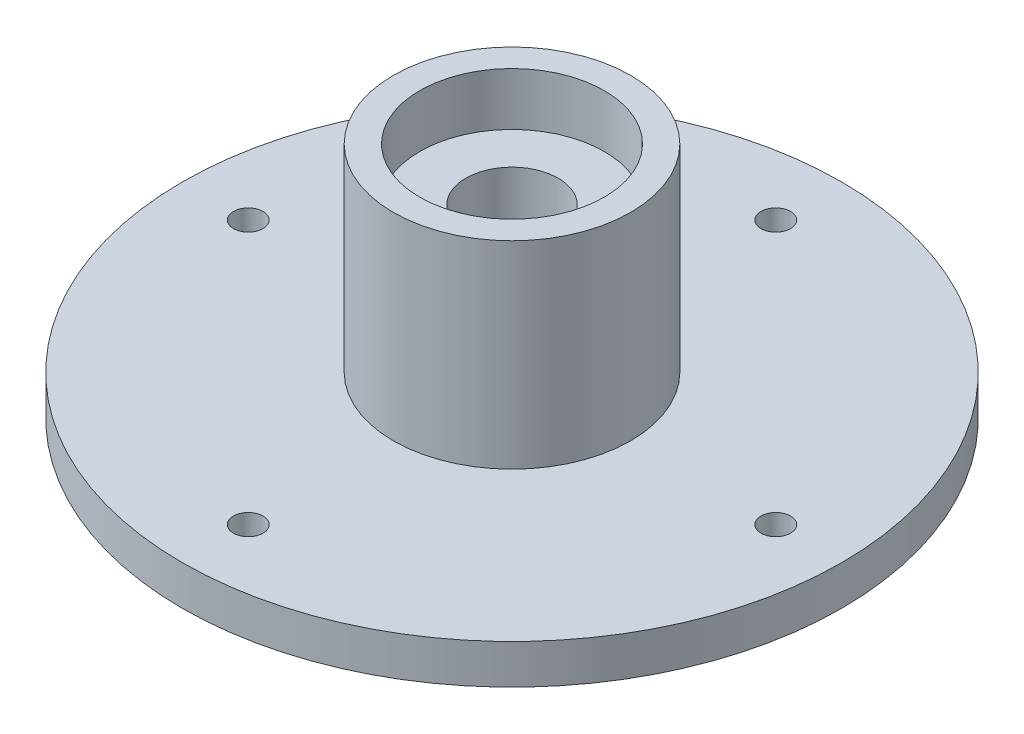
from build123d import *

# Parameters (mm, degrees)
SKETCH2_R           = 50
BOSS_EXTRUDE1_DEPTH = 6
SKETCH3_R           = 18
BOSS_EXTRUDE2_DEPTH = 30
SKETCH4_R           = 7
CUT_EXTRUDE1_DEPTH  = 80.3473377
SKETCH5_R           = 14
CUT_EXTRUDE2_DEPTH  = 8
CUT_EXTRUDE3_START  = -8
SKETCH6_R           = 14
CUT_EXTRUDE3_DEPTH  = 8
SKETCH7_R           = 2.25
CUT_EXTRUDE4_DEPTH  = 80.3473377
CIRPATTERN1_COUNT   = 4


with BuildPart() as part:
    # Sketch2 → Boss-Extrude1 (new body)
    with BuildSketch(Plane(origin=(0, 0, 0), x_dir=(1, 0, 0), z_dir=(0, 1, 0))):
        with Locations(Location((0, 0, 0), (0, 0, 270))):
            Circle(SKETCH2_R)
    extrude(amount=BOSS_EXTRUDE1_DEPTH)

    # Sketch3 → Boss-Extrude2 (add)
    with BuildSketch(Plane(origin=(0, 6, 0), x_dir=(1, 0, 0), z_dir=(0, 1, 0))):
        with Locations(Location((0, 0, 0), (0, 0, 270))):
            Circle(SKETCH3_R)
    extrude(amount=BOSS_EXTRUDE2_DEPTH)

    # Sketch4 → Cut-Extrude1 (cut, through all)
    with BuildSketch(Plane(origin=(0, 36, 0), x_dir=(1, 0, 0), z_dir=(0, 1, 0))):
        with Locations(Location((0, 0, 0), (0, 0, 270))):
            Circle(SKETCH4_R)
    extrude(amount=-CUT_EXTRUDE1_DEPTH, mode=Mode.SUBTRACT)

    # Sketch5 → Cut-Extrude2 (cut)
    with BuildSketch(Plane(origin=(0, 36, 0), x_dir=(1, 0, 0), z_dir=(0, 1, 0))):
        with Locations(Location((0, 0, 0), (0, 0, 270))):
            Circle(SKETCH5_R)
    extrude(amount=-CUT_EXTRUDE2_DEPTH, mode=Mode.SUBTRACT)

    # Sketch6 → Cut-Extrude3 (cut)
    with BuildSketch(Plane.XZ.offset(CUT_EXTRUDE3_START)):
        with Locations(Location((0, 0, 0), (0, 0, 90))):
            Circle(SKETCH6_R)
    extrude(amount=CUT_EXTRUDE3_DEPTH, mode=Mode.SUBTRACT)

    # Sketch7 → Cut-Extrude4 (cut, through all)
    with BuildSketch(Plane.XZ):
        with Locations(Location((40, 0, 0), (0, 0, 270))):
            Circle(SKETCH7_R)
    cut_extrude4 = extrude(amount=-CUT_EXTRUDE4_DEPTH, mode=Mode.SUBTRACT)

    # CirPattern1: Cut-Extrude4 ×4 about axis
    cirpattern1_axis = Axis((0, 0, 0), (0, 1, 0))
    for i in range(1, CIRPATTERN1_COUNT):
        add(cut_extrude4.rotate(cirpattern1_axis, i * 360 / CIRPATTERN1_COUNT), mode=Mode.SUBTRACT)


solid = part.part
